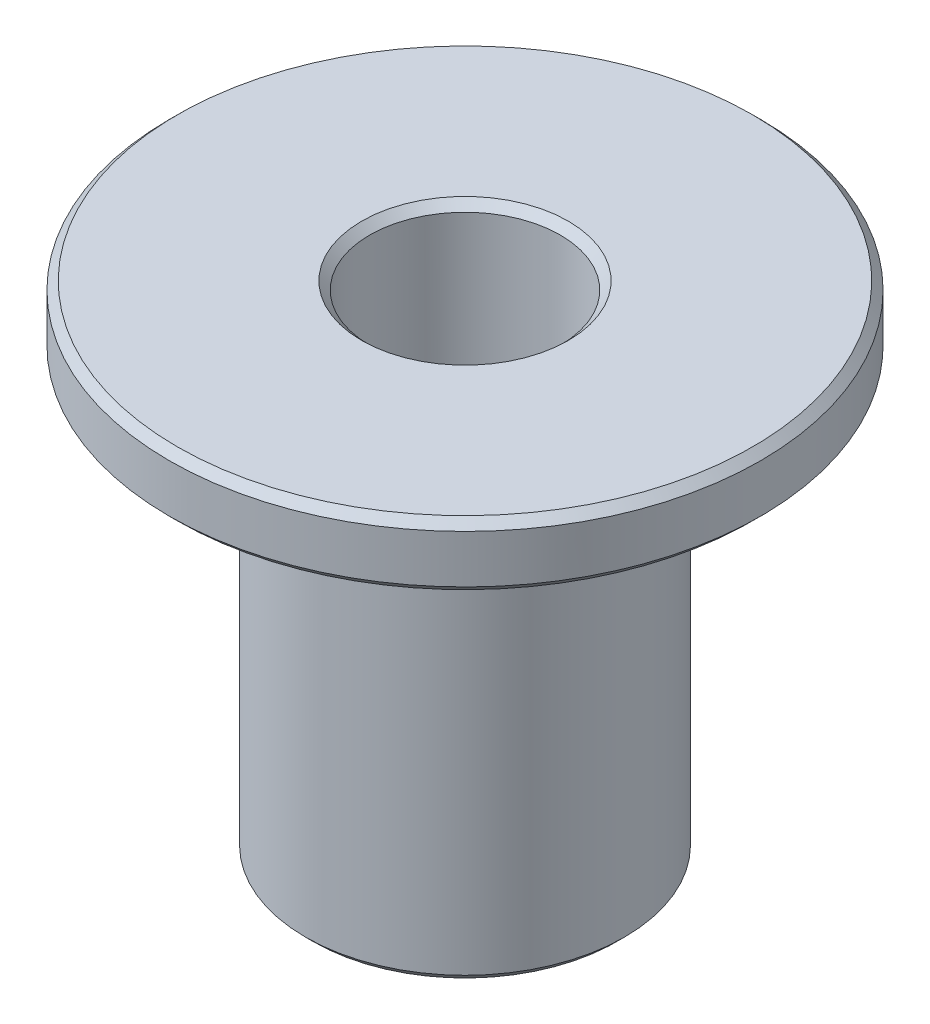
from build123d import *

# Parameters (mm, degrees)
CHANFREIN1_SIZE = 0.25


with BuildPart() as part:
    # Esquisse1 → Base-Révolution (revolve)
    with BuildSketch(Plane.XY, mode=Mode.PRIVATE) as base_r_volution_sk:
        Polygon((2.975, 14.5), (2.975, 30), (9.225, 30), (9.225, 28), (4.975, 28), (4.975, 14.5), align=None)
    revolve(base_r_volution_sk.sketch.rotate(Axis((0, 30, 0), (0, -1, 0)), 90), axis=Axis((0, 30, 0), (0, -1, 0)))

    # Chanfrein1
    chanfrein1_edges = [part.edges().sort_by_distance(p)[0] for p in [
        (0, 14.5, -2.975),
        (0, 30, -2.975),
        (0, 30, -9.225),
        (0, 28, -9.225),
        (0, 14.5, -4.975),
    ]]
    chamfer(chanfrein1_edges, length=CHANFREIN1_SIZE)


solid = part.part
